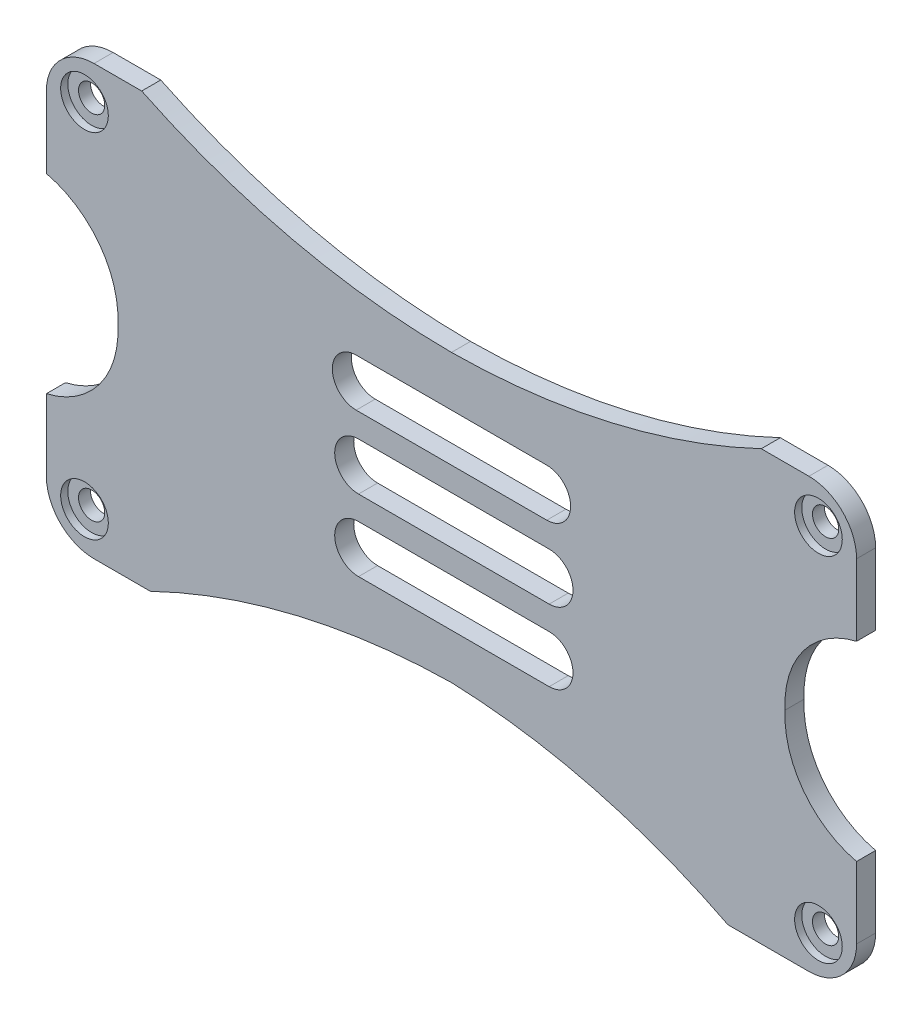
from build123d import *

# Parameters (mm, degrees)
EXTRUDE_1_DEPTH          = 4
CUT_EXTRUDE_1_DEPTH      = 42
CUT_EXTRUDE_1_DEPTH_BACK = 10
SKETCH_2_R               = 2.75
SKETCH_3_R               = 5
CUT_EXTRUDE_2_DEPTH      = 1.5


with BuildPart() as part:
    # 草图1 → 凸台-拉伸1 (new body)
    with BuildSketch(Plane.XY):
        with BuildLine():
            Line((-72.574116531, 45.487390308), (77.425883469, 45.487390308))
            ThreePointArc((77.425883469, 45.487390308), (84.496951281, 42.558458119), (87.425883469, 35.487390308))
            Line((87.425883469, 35.487390308), (87.425883469, -34.512609692))
            ThreePointArc((87.425883469, -34.512609692), (84.496951281, -41.583677504), (77.425883469, -44.512609692))
            Line((77.425883469, -44.512609692), (-72.574116531, -44.512609692))
            ThreePointArc((-72.574116531, -44.512609692), (-79.645184343, -41.583677504), (-82.574116531, -34.512609692))
            Line((-82.574116531, -34.512609692), (-82.574116531, 35.487390308))
            ThreePointArc((-82.574116531, 35.487390308), (-79.645184343, 42.558458119), (-72.574116531, 45.487390308))
        make_face()
    extrude(amount=EXTRUDE_1_DEPTH)

    # 草图2 → 切除-拉伸1 (cut, two sides: drawn at the far end of the back side and taken through both)
    with BuildSketch(Plane.XY.offset(4).offset(-CUT_EXTRUDE_1_DEPTH_BACK)):
        with Locations((-74.574116531, 37.487390308)):
            Circle(SKETCH_2_R)
        with Locations((-74.574116531, -36.512609692)):
            Circle(SKETCH_2_R)
        with Locations((79.425883469, 37.487390308)):
            Circle(SKETCH_2_R)
        with Locations((79.425883469, -36.512609692)):
            Circle(SKETCH_2_R)
        with BuildLine():
            Line((-60.749662301, -44.512609692), (60.437772164, -44.512609692))
            ThreePointArc((60.437772164, -44.512609692), (32.253211404, -33.835942142), (2.425883469, -29.512609692))
            ThreePointArc((2.425883469, -29.512609692), (-29.983273004, -33.55318593), (-60.749662301, -44.512609692))
        make_face()
        with BuildLine():
            Line((-62.574116531, 45.487390308), (67.425883469, 45.487390308))
            ThreePointArc((67.425883469, 45.487390308), (35.747267057, 34.428061428), (2.425883469, 30.487390308))
            ThreePointArc((2.425883469, 30.487390308), (-30.918540876, 34.328218147), (-62.574116531, 45.487390308))
        make_face()
        with BuildLine():
            Line((87.425883469, 20.487390308), (87.425883469, -19.512609692))
            ThreePointArc((87.425883469, -19.512609692), (76.286181126, -12.242386449), (72.425883469, 0.487390308))
            ThreePointArc((72.425883469, 0.487390308), (76.286181126, 13.217167065), (87.425883469, 20.487390308))
        make_face()
        with BuildLine():
            Line((-82.574116531, 20.487390308), (-82.574116531, -19.512609692))
            ThreePointArc((-82.574116531, -19.512609692), (-71.434414188, -12.242386449), (-67.574116531, 0.487390308))
            ThreePointArc((-67.574116531, 0.487390308), (-71.434414188, 13.217167065), (-82.574116531, 20.487390308))
        make_face()
        with BuildLine():
            Line((-17.574116531, 20), (22.425883469, 20))
            ThreePointArc((22.425883469, 20), (27.425883469, 15), (22.425883469, 10))
            Line((22.425883469, 10), (-17.574116531, 10))
            ThreePointArc((-17.574116531, 10), (-22.574116531, 15), (-17.574116531, 20))
        make_face()
        with BuildLine():
            Line((-17.079364826, 5), (22.920635174, 5))
            ThreePointArc((22.920635174, 5), (27.920635174, 0), (22.920635174, -5))
            Line((22.920635174, -5), (-17.079364826, -5))
            ThreePointArc((-17.079364826, -5), (-22.079364826, 0), (-17.079364826, 5))
        make_face()
        with BuildLine():
            Line((-17.079364826, -10), (22.920635174, -10))
            ThreePointArc((22.920635174, -10), (27.920635174, -15), (22.920635174, -20))
            Line((22.920635174, -20), (-17.079364826, -20))
            ThreePointArc((-17.079364826, -20), (-22.079364826, -15), (-17.079364826, -10))
        make_face()
    extrude(amount=CUT_EXTRUDE_1_DEPTH + CUT_EXTRUDE_1_DEPTH_BACK, mode=Mode.SUBTRACT)

    # 草图3 → 切除-拉伸2 (cut)
    with BuildSketch(Plane.XY.offset(4)):
        with Locations((-74.574116531, 37.487390308)):
            Circle(SKETCH_3_R)
        with Locations((79.425883469, 37.487390308)):
            Circle(SKETCH_3_R)
        with Locations((79.425883469, -36.512609692)):
            Circle(SKETCH_3_R)
        with Locations((-74.574116531, -36.512609692)):
            Circle(SKETCH_3_R)
    extrude(amount=-CUT_EXTRUDE_2_DEPTH, mode=Mode.SUBTRACT)


solid = part.part
